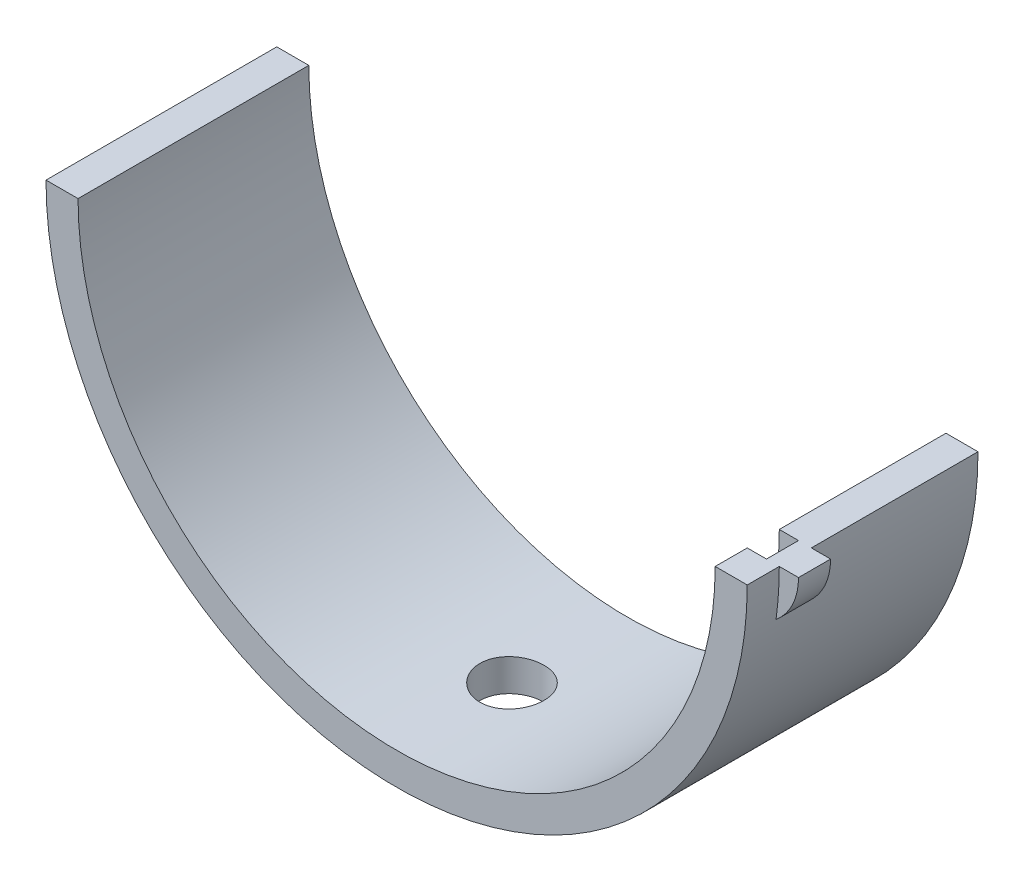
from build123d import *

# Parameters (mm, degrees)
BOSS_EXTRUDE1_DEPTH     = 9.144
CUT_EXTRUDE1_REACH      = 23.672
CUT_EXTRUDE1_END_RADIUS = 12.6238
SKETCH2_R               = 1.27
BOSS_EXTRUDE2_DEPTH     = 1.27
CUT_EXTRUDE2_DEPTH      = 1.27


with BuildPart() as part:
    # Sketch1 → Boss-Extrude1 (new body)
    with BuildSketch(Plane.XY):
        with BuildLine():
            Line((13.8938, 13.8938), (12.6238, 13.8938))
            ThreePointArc((12.6238, 13.8938), (0, 1.27), (-12.6238, 13.8938))
            Line((-12.6238, 13.8938), (-13.8938, 13.8938))
            ThreePointArc((-13.8938, 13.8938), (0, 0), (13.8938, 13.8938))
        make_face()
    extrude(amount=-BOSS_EXTRUDE1_DEPTH)

    # Cut-Extrude1: up to this cylinder (the profile starts outside it)
    cut_extrude1_end = Plane(origin=(0, 13.8938, -4.572), z_dir=(0, 0, 1)) * Cylinder(CUT_EXTRUDE1_END_RADIUS, 73.5916, mode=Mode.PRIVATE)
    # Sketch2 → Cut-Extrude1 (cut, up to the surface)
    with BuildSketch(Plane(origin=(0, 0, 0), x_dir=(1, 0, 0), z_dir=(0, 1, 0)), mode=Mode.PRIVATE) as cut_extrude1_sk1:
        with Locations(Location((0, 4.572, 0), (0, 0, 90))):
            Circle(SKETCH2_R)
    cut_extrude1_tool1 = extrude(cut_extrude1_sk1.sketch, amount=CUT_EXTRUDE1_REACH, mode=Mode.PRIVATE) - cut_extrude1_end
    add(cut_extrude1_tool1.solids().sort_by_distance((0, 0, -4.572))[0], mode=Mode.SUBTRACT)

    # Sketch3 → Boss-Extrude2 (add)
    with BuildSketch(Plane.XY.offset(-1.27)):
        with BuildLine():
            Line((13.8938, 13.8938), (14.6558, 13.8938))
            ThreePointArc((14.6558, 13.8938), (14.422114074, 12.853667951), (13.765971607, 12.013453184))
            ThreePointArc((13.765971607, 12.013453184), (13.861806065, 12.951456612), (13.8938, 13.8938))
        make_face()
    extrude(amount=-BOSS_EXTRUDE2_DEPTH)

    # Sketch4 → Cut-Extrude2 (cut)
    with BuildSketch(Plane.XY.offset(-1.27)):
        with BuildLine():
            Line((13.3858, 13.8938), (12.6238, 13.8938))
            ThreePointArc((12.6238, 13.8938), (12.588544092, 12.95099351), (12.482973295, 12.013453184))
            ThreePointArc((12.482973295, 12.013453184), (13.148398246, 12.850871406), (13.3858, 13.8938))
        make_face()
    extrude(amount=-CUT_EXTRUDE2_DEPTH, mode=Mode.SUBTRACT)


solid = part.part
